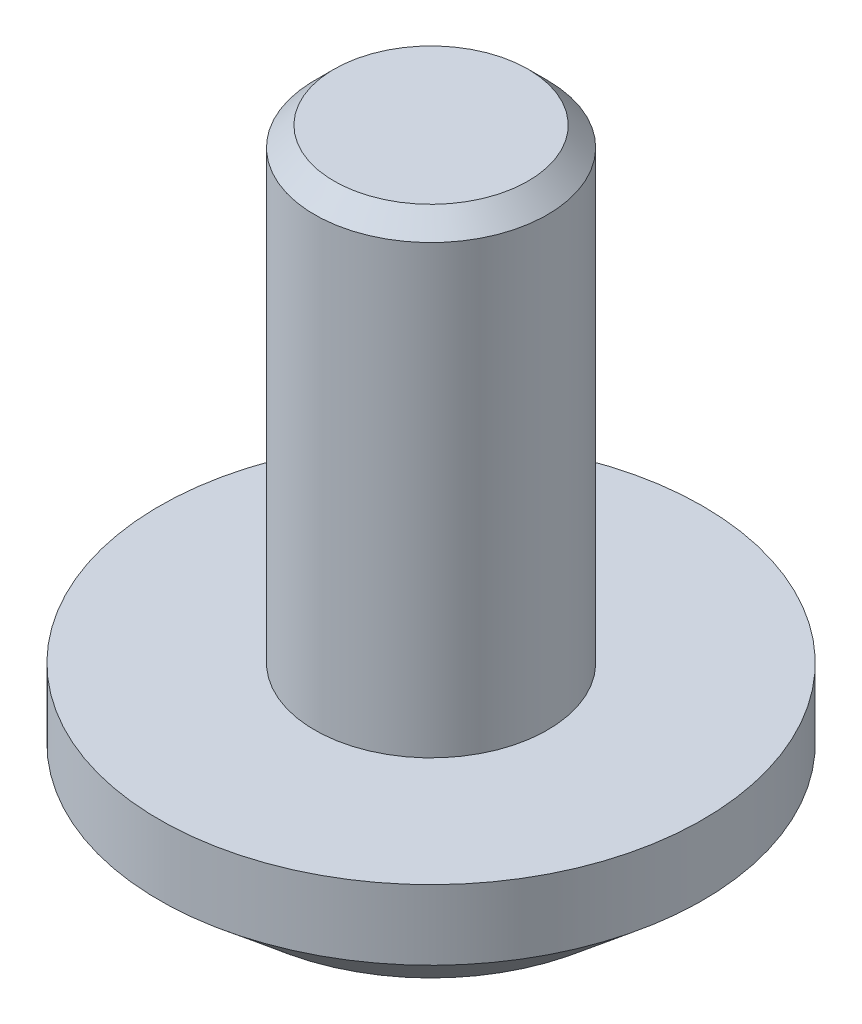
from build123d import *

# Parameters (mm, degrees)
CUT_EXTRUDE_1_REACH = 11.238


with BuildPart() as part:
    # 草图1 → 旋转1 (revolve)
    with BuildSketch(Plane.XY, mode=Mode.PRIVATE) as revolve_1_sk:
        Polygon((1.5, 0), (1.5, 5.75), (1.25, 6), (0, 6), (0, 0), (1, -0.600860619), (1, -1.8), (2.427421767, -1.8), (3.5, -0.9), (3.5, 0), align=None)
    revolve(revolve_1_sk.sketch.rotate(Axis((0, 0, 0), (0, 1, 0)), 90), axis=Axis((0, 0, 0), (0, 1, 0)))

    # 切除-拉伸1: up to this cone (the profile starts inside it)
    cut_extrude_1_end = Plane(origin=(0, -1.8, 0), z_dir=(0, -1, 0)).offset(-1.799999) * Cone(1.664e-06, 27.516702784, 16.533702068, align=(Align.CENTER, Align.CENTER, Align.MIN), mode=Mode.PRIVATE)
    # 草图2 → 切除-拉伸1 (cut, up to the surface)
    with BuildSketch(Plane.XZ.offset(1.8), mode=Mode.PRIVATE) as cut_extrude_1_sk1:
        Polygon((1.154700538, 0), (0.577350269, 1), (-0.577350269, 1), (-1.154700538, 0), (-0.577350269, -1), (0.577350269, -1), align=None)
    cut_extrude_1_tool1 = extrude(cut_extrude_1_sk1.sketch, amount=-CUT_EXTRUDE_1_REACH, mode=Mode.PRIVATE) & cut_extrude_1_end
    add(cut_extrude_1_tool1.solids().sort_by_distance((0, -1.8, 0))[0], mode=Mode.SUBTRACT)


solid = part.part
